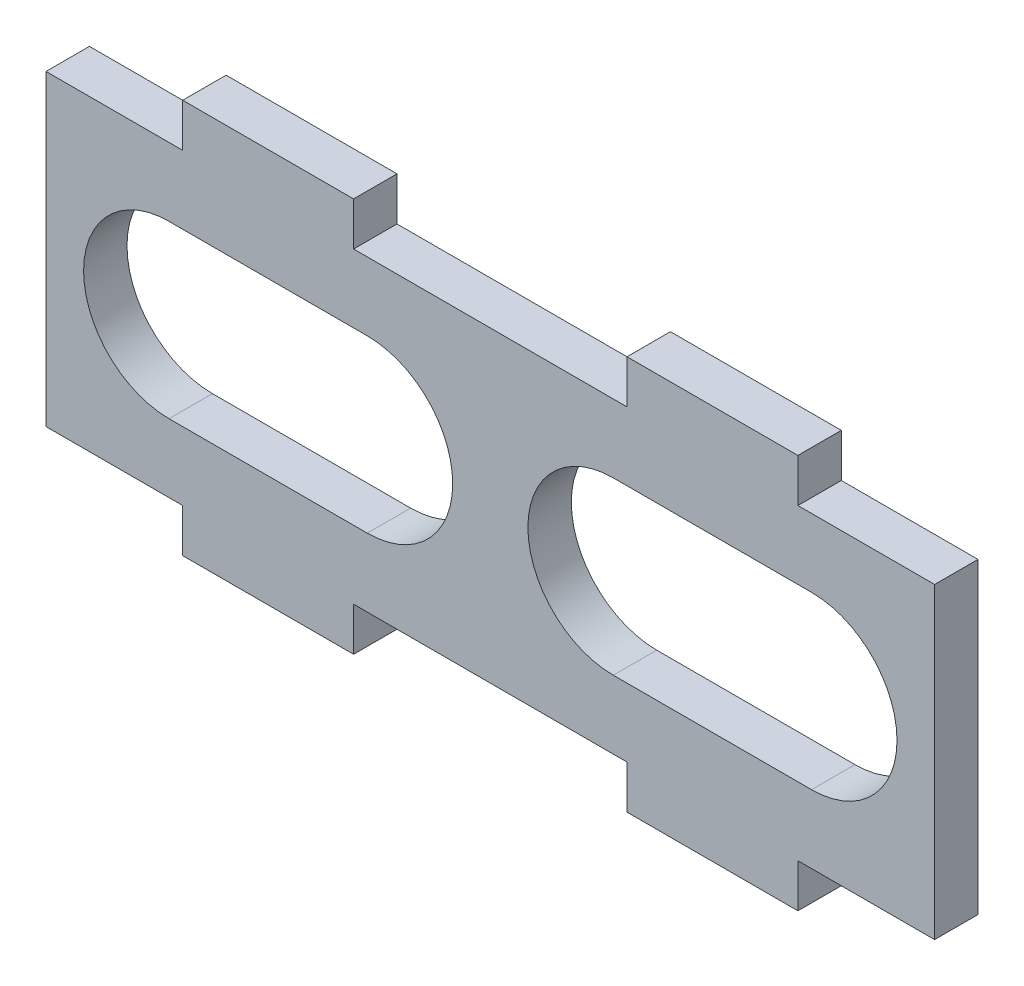
from build123d import *

# Parameters (mm, degrees)
ESQUISSE1_W             = 130
ESQUISSE1_H             = 45
BOSS_EXTRU_1_DEPTH      = 6.35
ENL_V_MAT_EXTRU_1_REACH = 81.312
ESQUISSE3_W             = 25
ESQUISSE3_H             = 6.35
BOSS_EXTRU_2_DEPTH      = 6.35


with BuildPart() as part:
    # Esquisse1 → Boss.-Extru.1 (new body)
    with BuildSketch(Plane.XY):
        with Locations((0, 22.5)):
            Rectangle(ESQUISSE1_W, ESQUISSE1_H)
    extrude(amount=BOSS_EXTRU_1_DEPTH)

    # Esquisse2 → Enlèv. mat.-Extru.1 (cut, up to next)
    with BuildSketch(Plane.XY.offset(6.35), mode=Mode.PRIVATE) as enl_v_mat_extru_1_sk1:
        with BuildLine():
            Line((-47, 35), (-18, 35))
            ThreePointArc((-18, 35), (-5.5, 22.5), (-18, 10))
            Line((-18, 10), (-47, 10))
            ThreePointArc((-47, 10), (-59.5, 22.5), (-47, 35))
        make_face()
    enl_v_mat_extru_1_tool1 = extrude(enl_v_mat_extru_1_sk1.sketch, amount=-ENL_V_MAT_EXTRU_1_REACH, mode=Mode.PRIVATE) & part.part
    # Esquisse2 → Enlèv. mat.-Extru.1 (cut, up to next)
    with BuildSketch(Plane.XY.offset(6.35), mode=Mode.PRIVATE) as enl_v_mat_extru_1_sk2:
        with BuildLine():
            Line((47, 35), (18, 35))
            ThreePointArc((18, 35), (5.5, 22.5), (18, 10))
            Line((18, 10), (47, 10))
            ThreePointArc((47, 10), (59.5, 22.5), (47, 35))
        make_face()
    enl_v_mat_extru_1_tool2 = extrude(enl_v_mat_extru_1_sk2.sketch, amount=-ENL_V_MAT_EXTRU_1_REACH, mode=Mode.PRIVATE) & part.part
    add(enl_v_mat_extru_1_tool1.solids().sort_by_distance((-32.5, 22.5, 6.35))[0], mode=Mode.SUBTRACT)
    add(enl_v_mat_extru_1_tool2.solids().sort_by_distance((32.5, 22.5, 6.35))[0], mode=Mode.SUBTRACT)

    # Esquisse3 → Boss.-Extru.2 (add)
    with BuildSketch(Plane.XY.offset(6.35)):
        with Locations((-32.5, 48.175)):
            Rectangle(ESQUISSE3_W, ESQUISSE3_H)
        with Locations((-32.5, -3.175)):
            Rectangle(ESQUISSE3_W, ESQUISSE3_H)
        with Locations((32.5, 48.175)):
            Rectangle(ESQUISSE3_W, ESQUISSE3_H)
        with Locations((32.5, -3.175)):
            Rectangle(ESQUISSE3_W, ESQUISSE3_H)
    extrude(amount=-BOSS_EXTRU_2_DEPTH)


solid = part.part
